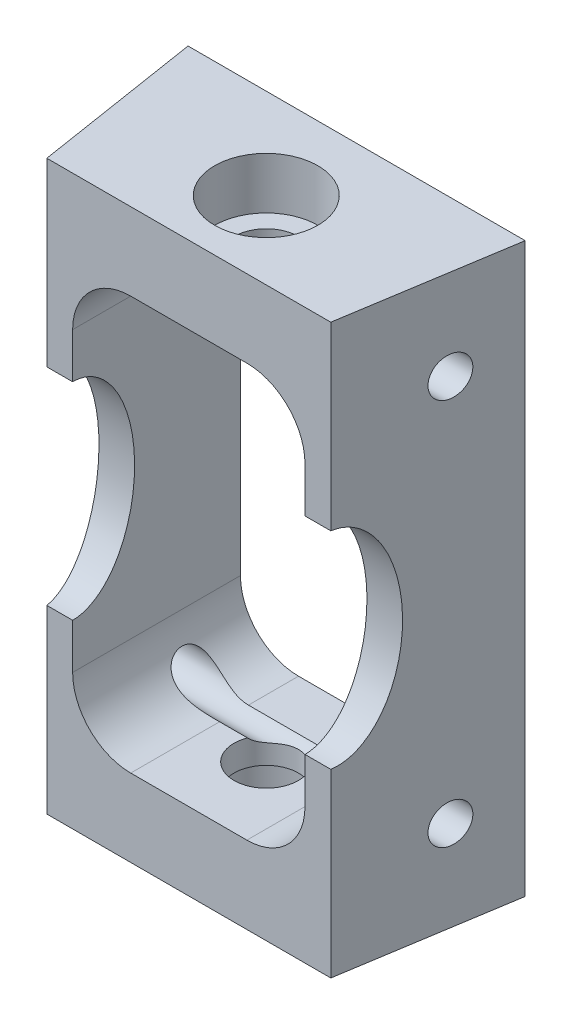
from build123d import *

# Parameters (mm, degrees)
BOSS_EXTRUDE1_DEPTH            = 22
BOSS_EXTRUDE1_DEPTH_BACK       = 22
BOSS_EXTRUDE3_DEPTH            = 18
BOSS_EXTRUDE3_DEPTH_BACK       = 18
SKETCH5_R                      = 4
SKETCH5_R_2                    = 2.5
CUT_EXTRUDE1_DEPTH             = 43
CUT_EXTRUDE1_DEPTH_BACK        = 43
SKETCH3_R                      = 1.5
CUT_EXTRUDE3_DEPTH             = 27
CUT_EXTRUDE3_DEPTH_BACK        = 24
CUT_EXTRUDE4_REACH             = 30.697
SKETCH7_RX                     = 8
SKETCH7_RY                     = 4.8
CUT_EXTRUDE4_DIRECTION_2_REACH = 30.697


with BuildPart() as part:
    # Sketch1 → Boss-Extrude1 (new, two sides: drawn at the far end of the back side and taken through both)
    with BuildSketch(Plane(origin=(0, 0, 0), x_dir=(1, 0, 0), z_dir=(0, 1, 0)).offset(-BOSS_EXTRUDE1_DEPTH_BACK)):
        with BuildLine():
            Line((-11.950306642, 6), (-11, 0))
            Line((-11, 0), (11, 0))
            Line((11, 0), (11.950306642, 6))
            Line((11.950306642, 6), (4, 6))
            ThreePointArc((4, 6), (0, 2), (-4, 6))
            Line((-4, 6), (-11.950306642, 6))
        make_face()
        with BuildLine():
            Line((-7.641307543, 10), (-11.950306642, 6))
            Line((-11.950306642, 6), (-4, 6))
            ThreePointArc((-4, 6), (0, 10), (4, 6))
            Line((4, 6), (11.950306642, 6))
            Line((11.950306642, 6), (7.641307543, 10))
            ThreePointArc((7.641307543, 10), (4.104557854, 12.223132826), (-1.7e-08, 13))
            ThreePointArc((-1.7e-08, 13), (-4.10455787, 12.223132819), (-7.641307543, 10))
        make_face()
        with BuildLine():
            Line((-13.058997724, 13), (-11.950306642, 6))
            Line((-11.950306642, 6), (-7.641307543, 10))
            ThreePointArc((-7.641307543, 10), (-4.10455787, 12.223132819), (-1.7e-08, 13))
            Line((-1.7e-08, 13), (-2.687473981, 13))
            Line((-2.687473981, 13), (-13.058997724, 13))
        make_face()
        with BuildLine():
            Line((7.641307543, 10), (11.950306642, 6))
            Line((11.950306642, 6), (13.058997724, 13))
            Line((13.058997724, 13), (2.687473981, 13))
            Line((2.687473981, 13), (-1.7e-08, 13))
            ThreePointArc((-1.7e-08, 13), (4.104557854, 12.223132826), (7.641307543, 10))
        make_face()
    extrude(amount=BOSS_EXTRUDE1_DEPTH + BOSS_EXTRUDE1_DEPTH_BACK)

    # Sketch5 → Boss-Extrude3 (add, two sides: drawn at the far end of the back side and taken through both)
    with BuildSketch(Plane(origin=(0, 0, 0), x_dir=(1, 0, 0), z_dir=(0, 1, 0)).offset(-BOSS_EXTRUDE3_DEPTH_BACK)):
        with Locations(Location((0, 6, 0), (0, 0, 270))):
            Circle(SKETCH5_R)
        with Locations(Location((0, 6, 0), (0, 0, 270))):
            Circle(SKETCH5_R_2, mode=Mode.SUBTRACT)
    extrude(amount=BOSS_EXTRUDE3_DEPTH + BOSS_EXTRUDE3_DEPTH_BACK)

    # Sketch3 → Cut-Extrude1 (cut, two sides: drawn at the far end of the back side and taken through both)
    with BuildSketch(Plane(origin=(0, 0, 0), x_dir=(0, 0, -1), z_dir=(1, 0, 0)).offset(-CUT_EXTRUDE1_DEPTH_BACK)):
        with Locations(Location((8, 15, 0), (0, 0, 180))):
            Circle(SKETCH3_R)
        with Locations(Location((8, -15, 0), (0, 0, 180))):
            Circle(SKETCH3_R)
    extrude(amount=CUT_EXTRUDE1_DEPTH + CUT_EXTRUDE1_DEPTH_BACK, mode=Mode.SUBTRACT)

    # Sketch6 → Cut-Extrude3 (cut, two sides: drawn at the far end of the back side and taken through both)
    with BuildSketch(Plane.XY.offset(-CUT_EXTRUDE3_DEPTH_BACK)):
        with BuildLine():
            ThreePointArc((-9, -11.5), (-7.681980515, -14.681980515), (-4.5, -16))
            Line((-4.5, -16), (4.5, -16))
            ThreePointArc((4.5, -16), (7.681980515, -14.681980515), (9, -11.5))
            Line((9, -11.5), (9, 11.5))
            ThreePointArc((9, 11.5), (7.681980515, 14.681980515), (4.5, 16))
            Line((4.5, 16), (-4.5, 16))
            ThreePointArc((-4.5, 16), (-7.681980515, 14.681980515), (-9, 11.5))
            Line((-9, 11.5), (-9, -11.5))
        make_face()
    extrude(amount=CUT_EXTRUDE3_DEPTH + CUT_EXTRUDE3_DEPTH_BACK, mode=Mode.SUBTRACT)

    # Cut-Extrude4: up to this plane
    cut_extrude4_end = Plane(origin=(-10.73081084, -22, 1.699593469), z_dir=(-0.9876883405951371, 0, 0.15643446504023473))
    # Sketch7 → Cut-Extrude4 (cut, up to the surface)
    with BuildSketch(Plane(origin=(0, 0, 0), x_dir=(0, 0, -1), z_dir=(1, 0, 0)), mode=Mode.PRIVATE) as cut_extrude4_sk1:
        with Locations(Location((0, 0), (0, 0, 90))):
            Ellipse(SKETCH7_RX, SKETCH7_RY)
    cut_extrude4_tool1 = split(extrude(cut_extrude4_sk1.sketch, amount=-CUT_EXTRUDE4_REACH, mode=Mode.PRIVATE), bisect_by=cut_extrude4_end, keep=Keep.BOTH, mode=Mode.PRIVATE)
    add(cut_extrude4_tool1.solids().sort_by_distance((0, 0, 0))[0], mode=Mode.SUBTRACT)

    # Cut-Extrude4 direction 2: up to this plane
    cut_extrude4_direction_2_end = Plane(origin=(10.73081084, -22, 1.699593469), z_dir=(-0.9876883405951371, 0, -0.15643446504023442))
    # Sketch7 → Cut-Extrude4 direction 2 (cut, up to the surface)
    with BuildSketch(Plane(origin=(0, 0, 0), x_dir=(0, 0, -1), z_dir=(1, 0, 0)), mode=Mode.PRIVATE) as cut_extrude4_direction_2_sk1:
        with Locations(Location((0, 0), (0, 0, 90))):
            Ellipse(SKETCH7_RX, SKETCH7_RY)
    cut_extrude4_direction_2_tool1 = split(extrude(cut_extrude4_direction_2_sk1.sketch, amount=CUT_EXTRUDE4_DIRECTION_2_REACH, mode=Mode.PRIVATE), bisect_by=cut_extrude4_direction_2_end, keep=Keep.BOTH, mode=Mode.PRIVATE)
    add(cut_extrude4_direction_2_tool1.solids().sort_by_distance((0, 0, 0))[0], mode=Mode.SUBTRACT)


solid = part.part
